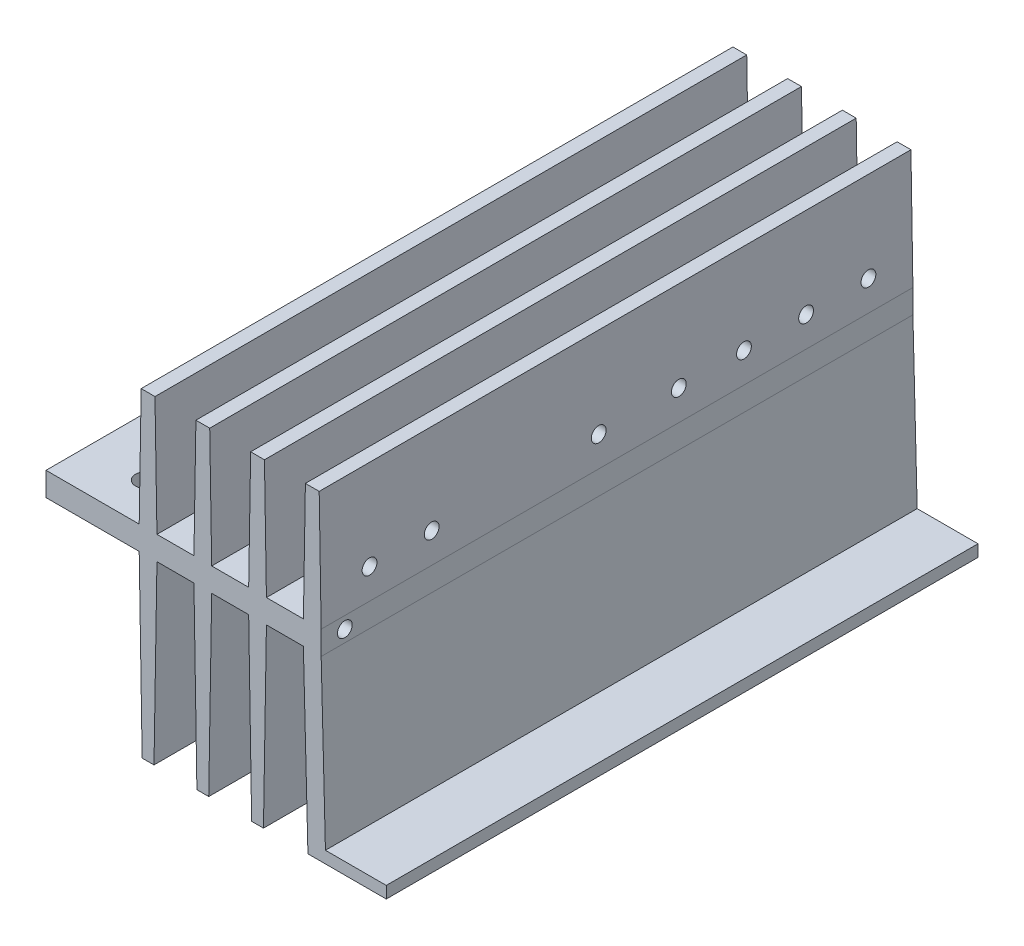
from build123d import *

# Parameters (mm, degrees)
SKICA1_W                 = 93
SKICA1_H                 = 4
P_IDAT_VYSUNUT_M1_DEPTH  = 100
SKICA2_W                 = 121.490565888
SKICA2_H                 = 20.366839506
ODEBRAT_VYSUNUT_M1_DEPTH = 204.75436619
SKICA3_W                 = 67.97848113
SKICA3_H                 = 83.569638829
ODEBRAT_VYSUNUT_M2_DEPTH = 198.590610741
SKICA4_R                 = 1.25
ODEBRAT_VYSUNUT_M3_DEPTH = 5
SKICA5_R                 = 1.25
ODEBRAT_VYSUNUT_M4_DEPTH = 16
SKICA6_R                 = 1.25
ODEBRAT_VYSUNUT_M5_DEPTH = 5
SKICA7_R                 = 1.75
ODEBRAT_VYSUNUT_M6_DEPTH = 10


with BuildPart() as part:
    # Skica1 → Přidat vysunutím1 (new body)
    with BuildSketch(Plane.XY):
        Polygon((83.039921415, 64.689614429), (83.539921415, 94.689614429), (80.539921415, 94.689614429), (81.039921415, 64.689614429), align=None)
        Polygon((92.289921415, 64.689614429), (92.789921415, 94.689614429), (89.789921415, 94.689614429), (90.289921415, 64.689614429), align=None)
        Polygon((101.539921415, 64.689614429), (102.039921415, 94.689614429), (99.039921415, 94.689614429), (99.539921415, 64.689614429), align=None)
        Polygon((112.011784527, 66.689614429), (111.289921415, 94.689614429), (108.281882654, 94.689614429), (109.055307417, 64.689614429), (122.289921415, 64.689614429), (122.289921415, 66.689614429), align=None)
        Polygon((108.289921415, 98.689614429), (111.289921415, 98.689614429), (110.789921415, 128.689614429), (108.789921415, 128.689614429), align=None)
        Polygon((99.039921415, 98.689614429), (102.039921415, 98.689614429), (101.539921415, 128.689614429), (99.539921415, 128.689614429), align=None)
        Polygon((89.789921415, 98.689614429), (92.789921415, 98.689614429), (92.289921415, 128.689614429), (90.289921415, 128.689614429), align=None)
        Polygon((80.539921415, 98.689614429), (83.539921415, 98.689614429), (83.039921415, 128.689614429), (81.039921415, 128.689614429), align=None)
        with Locations((64.789921415, 96.689614429)):
            Rectangle(SKICA1_W, SKICA1_H)
        Polygon((27.539921415, 98.689614429), (30.539921415, 98.689614429), (30.039921415, 128.689614429), (28.039921415, 128.689614429), align=None)
        Polygon((36.789921415, 98.689614429), (39.789921415, 98.689614429), (39.289921415, 128.689614429), (37.289921415, 128.689614429), align=None)
        Polygon((46.039921415, 98.689614429), (49.039921415, 98.689614429), (48.539921415, 128.689614429), (46.539921415, 128.689614429), align=None)
        Polygon((18.289921415, 98.689614429), (21.289921415, 98.689614429), (20.789921415, 128.689614429), (18.789921415, 128.689614429), align=None)
        Polygon((20.524535413, 64.689614429), (21.297960175, 94.689614429), (18.289921415, 94.689614429), (17.568058303, 66.689614429), (7.289921415, 66.689614429), (7.289921415, 64.689614429), align=None)
        Polygon((30.039921415, 64.689614429), (30.539921415, 94.689614429), (27.539921415, 94.689614429), (28.039921415, 64.689614429), align=None)
        Polygon((39.289921415, 64.689614429), (39.789921415, 94.689614429), (36.789921415, 94.689614429), (37.289921415, 64.689614429), align=None)
        Polygon((48.539921415, 64.689614429), (49.039921415, 94.689614429), (46.039921415, 94.689614429), (46.539921415, 64.689614429), align=None)
    extrude(amount=P_IDAT_VYSUNUT_M1_DEPTH)

    # Skica2 → Odebrat vysunutím1 (cut, through all)
    with BuildSketch(Plane.XY.offset(100)):
        with Locations((69.111954217, 128.873034182)):
            Rectangle(SKICA2_W, SKICA2_H)
    extrude(amount=-ODEBRAT_VYSUNUT_M1_DEPTH, mode=Mode.SUBTRACT)

    # Skica3 → Odebrat vysunutím2 (cut, through all)
    with BuildSketch(Plane.XY.offset(100)):
        with Locations((30.80068085, 79.614929898)):
            Rectangle(SKICA3_W, SKICA3_H)
    extrude(amount=-ODEBRAT_VYSUNUT_M2_DEPTH, mode=Mode.SUBTRACT)

    # Skica4 → Odebrat vysunutím3 (cut)
    with BuildSketch(Plane(origin=(111.289921415, 0, 0), x_dir=(0, 0, -1), z_dir=(1, 0, 0))):
        with Locations(Location((-91.74, 103.689614429, 0), (0, 0, 90))):
            Circle(SKICA4_R)
        with Locations(Location((-81.24, 103.689614429, 0), (0, 0, 90))):
            Circle(SKICA4_R)
        with Locations(Location((-53.01, 103.689614429, 0), (0, 0, 90))):
            Circle(SKICA4_R)
        with Locations(Location((-28.47, 103.689614429, 0), (0, 0, 90))):
            Circle(SKICA4_R)
        with Locations(Location((-17.97, 103.689614429, 0), (0, 0, 90))):
            Circle(SKICA4_R)
        with Locations(Location((-7.43, 103.689614429, 0), (0, 0, 90))):
            Circle(SKICA4_R)
        with Locations(Location((-39.47, 103.689614429, 0), (0, 0, 90))):
            Circle(SKICA4_R)
    extrude(amount=-ODEBRAT_VYSUNUT_M3_DEPTH, mode=Mode.SUBTRACT)

    # Skica5 → Odebrat vysunutím4 (cut)
    with BuildSketch(Plane(origin=(111.289921415, 0, 0), x_dir=(0, 0, -1), z_dir=(1, 0, 0))):
        with Locations((-96, 96.689614429)):
            Circle(SKICA5_R)
    extrude(amount=-ODEBRAT_VYSUNUT_M4_DEPTH, mode=Mode.SUBTRACT)

    # Skica6 → Odebrat vysunutím5 (cut)
    with BuildSketch(Plane.XZ.offset(-94.689614429)):
        with Locations((74.677082764, 93)):
            Circle(SKICA6_R)
        with Locations((75.177082764, 5)):
            Circle(SKICA6_R)
        with Locations((75.177082764, 65)):
            Circle(SKICA6_R)
    extrude(amount=-ODEBRAT_VYSUNUT_M5_DEPTH, mode=Mode.SUBTRACT)

    # Skica7 → Odebrat vysunutím6 (cut)
    with BuildSketch(Plane.XZ.offset(-94.689614429)):
        with Locations((75.177082764, 5)):
            Circle(SKICA7_R)
        with Locations((74.677082764, 93)):
            Circle(SKICA7_R)
    extrude(amount=-ODEBRAT_VYSUNUT_M6_DEPTH, mode=Mode.SUBTRACT)


solid = part.part
